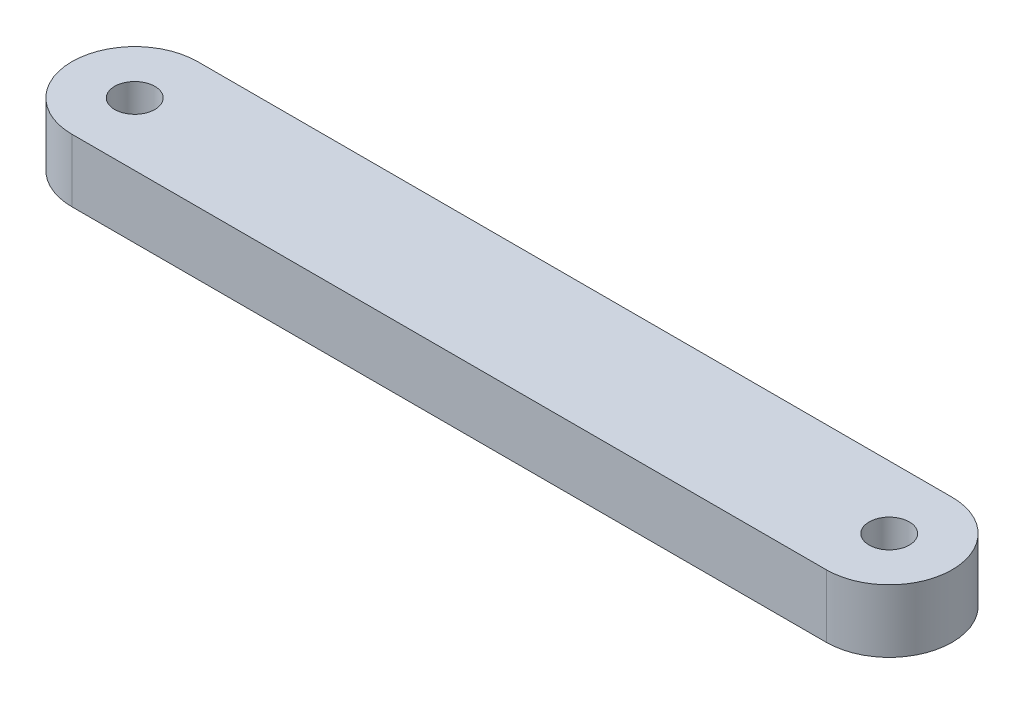
from build123d import *

# Parameters (mm, degrees)
SKETCH_1_R      = 1.6
EXTRUDE_1_DEPTH = 5


with BuildPart() as part:
    # ｽｹｯﾁ1 → ﾎﾞｽ - 押し出し1 (new body)
    with BuildSketch(Plane(origin=(0, 0, 0), x_dir=(1, 0, 0), z_dir=(0, 1, 0))):
        with BuildLine():
            Line((0, -5), (60, -5))
            ThreePointArc((60, -5), (65, 0), (60, 5))
            Line((60, 5), (0, 5))
            ThreePointArc((0, 5), (-5, 0), (0, -5))
        make_face()
        with Locations(Location((0, 0, 0), (0, 0, 270))):
            Circle(SKETCH_1_R, mode=Mode.SUBTRACT)
        with Locations(Location((60, 0, 0), (0, 0, 270))):
            Circle(SKETCH_1_R, mode=Mode.SUBTRACT)
    extrude(amount=EXTRUDE_1_DEPTH)


solid = part.part
